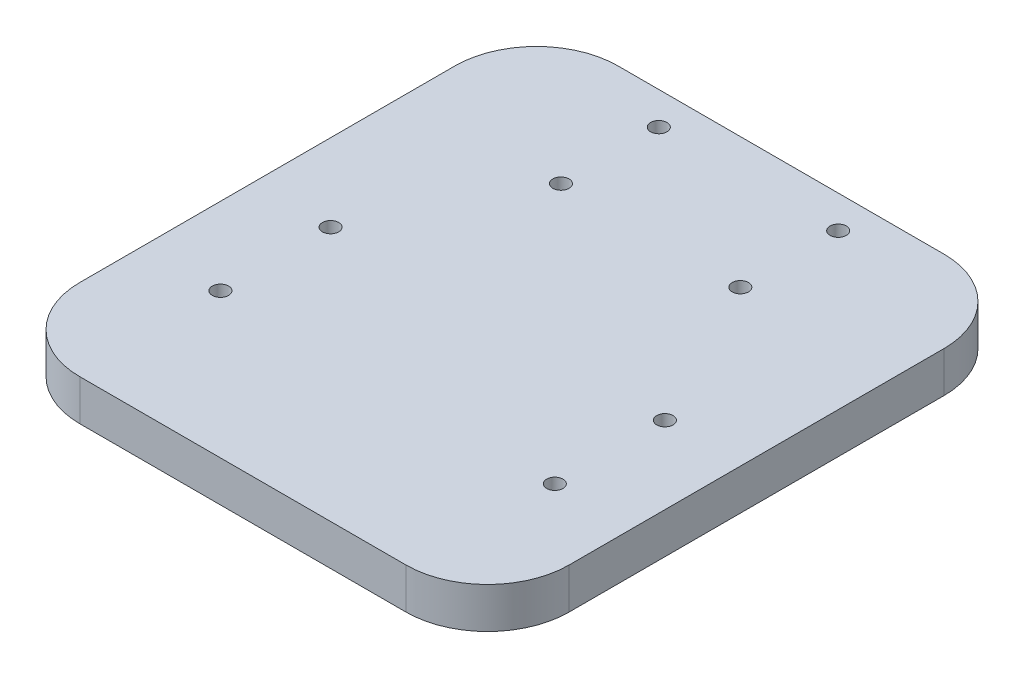
from build123d import *

# Parameters (mm, degrees)
SKETCH1_W           = 60
SKETCH1_H           = 66
BOSS_EXTRUDE1_DEPTH = 5
FILLET1_R           = 10
SHELL1_T            = -2
FILLET2_R           = 2
SKETCH3_R           = 1
CUT_EXTRUDE1_DEPTH  = 5


with BuildPart() as part:
    # Sketch1 → Boss-Extrude1 (new body)
    with BuildSketch(Plane.XZ.offset(23)):
        with Locations((0, -5)):
            Rectangle(SKETCH1_W, SKETCH1_H)
    extrude(amount=BOSS_EXTRUDE1_DEPTH)

    # Fillet1
    fillet1_edges = [part.edges().sort_by_distance(p)[0] for p in [
        (-30, -25.5, 28),
        (30, -25.5, 28),
        (30, -25.5, -38),
        (-30, -25.5, -38),
    ]]
    fillet(fillet1_edges, radius=FILLET1_R)

    # Shell1
    shell1_openings = [part.faces().sort_by_distance(p)[0] for p in [
        (0, -28, -5),
    ]]
    offset(amount=SHELL1_T, openings=shell1_openings, kind=Kind.INTERSECTION)

    # Fillet2
    fillet2_edges = [part.edges().sort_by_distance(p)[0] for p in [
        (-28, -25, -5),
        (0, -25, -36),
        (28, -25, -5),
        (0, -25, 26),
        (25.656854249, -25, -33.656854249),
        (-25.656854249, -25, -33.656854249),
        (-25.656854249, -25, 23.656854249),
        (25.656854249, -25, 23.656854249),
    ]]
    fillet(fillet2_edges, radius=FILLET2_R)

    # Sketch3 → Cut-Extrude1 (cut)
    with BuildSketch(Plane(origin=(0, -23, 0), x_dir=(1, 0, 0), z_dir=(0, 1, 0))):
        with Locations(Location((20.5, 3.25, 0), (0, 0, 270))):
            Circle(SKETCH3_R)
        with Locations(Location((20.5, -10.25, 0), (0, 0, 270))):
            Circle(SKETCH3_R)
        with Locations(Location((11, 34, 0), (0, 0, 270))):
            Circle(SKETCH3_R)
        with Locations(Location((11, 22, 0), (0, 0, 270))):
            Circle(SKETCH3_R)
        with Locations(Location((-11, 34, 0), (0, 0, 270))):
            Circle(SKETCH3_R)
        with Locations(Location((-11, 22, 0), (0, 0, 270))):
            Circle(SKETCH3_R)
        with Locations(Location((-20.5, 3.25, 0), (0, 0, 270))):
            Circle(SKETCH3_R)
        with Locations(Location((-20.5, -10.25, 0), (0, 0, 270))):
            Circle(SKETCH3_R)
    extrude(amount=-CUT_EXTRUDE1_DEPTH, mode=Mode.SUBTRACT)


solid = part.part
